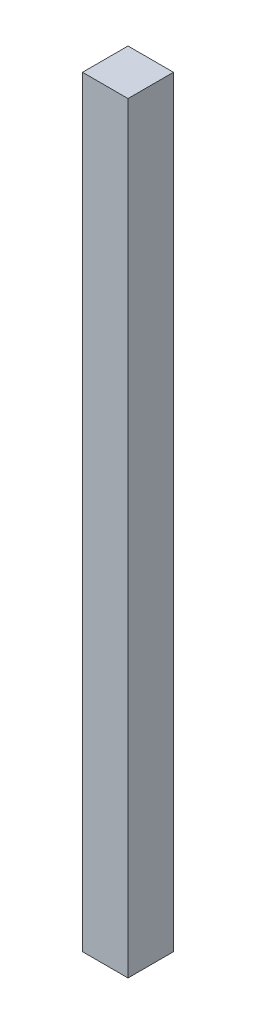
from build123d import *

# Parameters (mm, degrees)
SKETCH1_W           = 50.8
SKETCH1_H           = 50.8
BOSS_EXTRUDE1_DEPTH = 850.392


with BuildPart() as part:
    # Sketch1 → Boss-Extrude1 (new body)
    with BuildSketch(Plane(origin=(0, 0, 0), x_dir=(1, 0, 0), z_dir=(0, 1, 0))):
        Rectangle(SKETCH1_W, SKETCH1_H)
    extrude(amount=BOSS_EXTRUDE1_DEPTH)


solid = part.part
